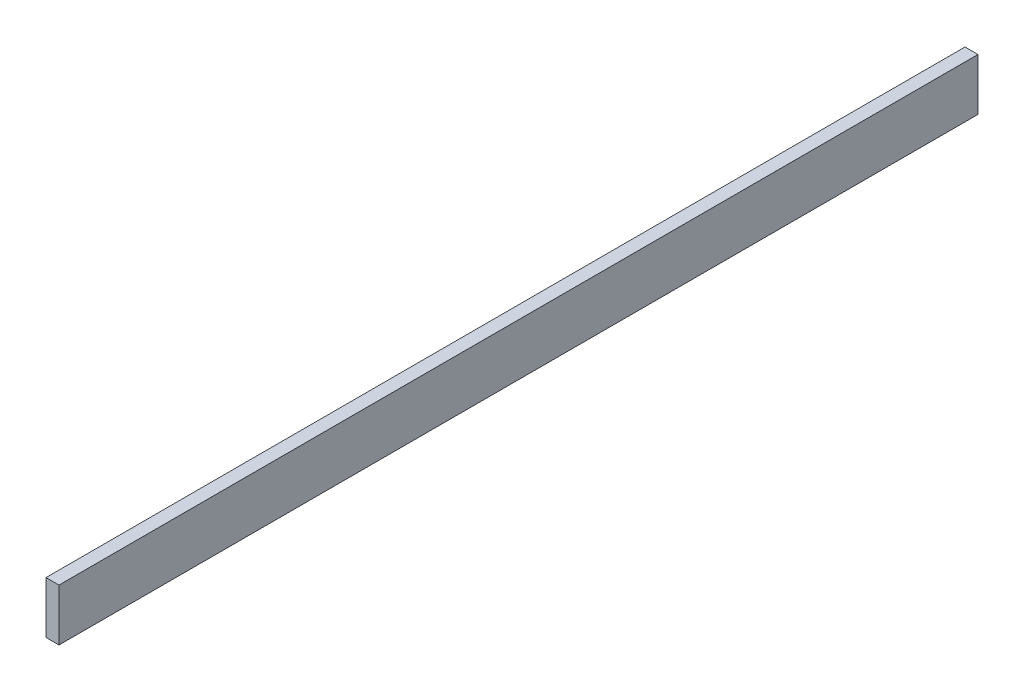
from build123d import *

# Parameters (mm, degrees)
SKETCH1_W           = 3.175
SKETCH1_H           = 12.7
BOSS_EXTRUDE1_DEPTH = 224.79


with BuildPart() as part:
    # Sketch1 → Boss-Extrude1 (new body)
    with BuildSketch(Plane.XY):
        with Locations((1.5875, 6.35)):
            Rectangle(SKETCH1_W, SKETCH1_H)
    extrude(amount=BOSS_EXTRUDE1_DEPTH)


solid = part.part
